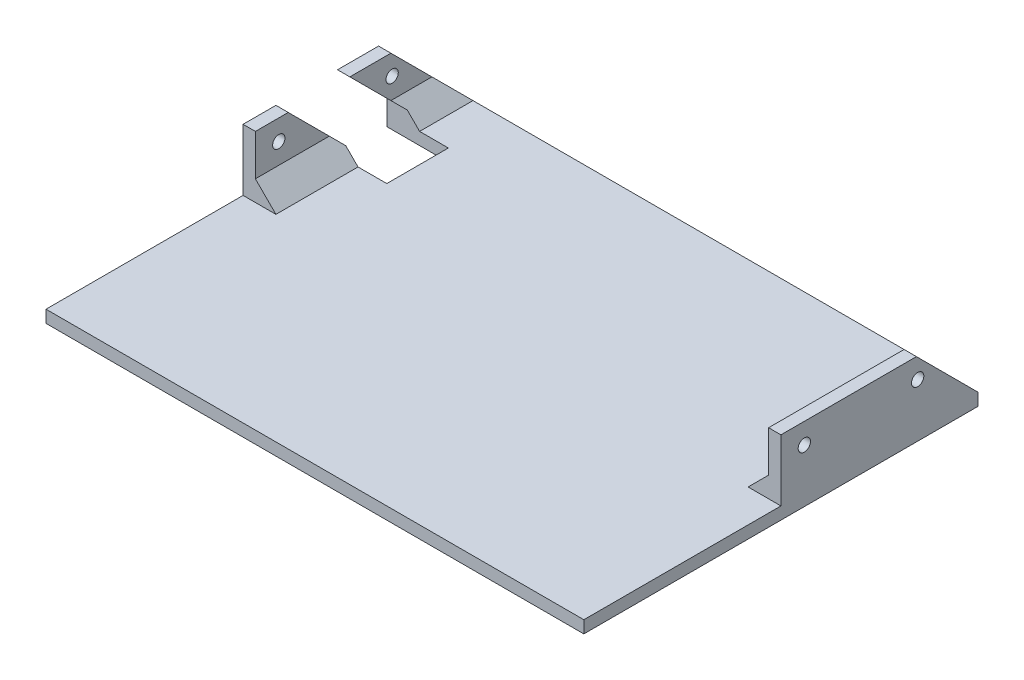
from build123d import *

# Parameters (mm, degrees)
SKETCH1_W           = 131
SKETCH1_H           = 96
BOSS_EXTRUDE1_DEPTH = 1.5
SKETCH2_R           = 1.5
BOSS_EXTRUDE2_DEPTH = 3
CHAMFER1_SIZE       = 5
CUT_EXTRUDE1_DEPTH  = 15


with BuildPart() as part:
    # Sketch1 → Boss-Extrude1 (new, symmetric)
    with BuildSketch(Plane(origin=(0, 0, 0), x_dir=(1, 0, 0), z_dir=(0, 1, 0))):
        Rectangle(SKETCH1_W, SKETCH1_H)
    extrude(amount=BOSS_EXTRUDE1_DEPTH, both=True)

    # Sketch2 → Boss-Extrude2 (add)
    with BuildSketch(Plane.ZY.offset(65.5)):
        Polygon((-33, 16.5), (-48, 1.5), (0, 1.5), (0, 16.5), align=None)
        with Locations((-33.3, 11.5)):
            Circle(SKETCH2_R, mode=Mode.SUBTRACT)
        with Locations((-5.7, 11.5)):
            Circle(SKETCH2_R, mode=Mode.SUBTRACT)
    boss_extrude2 = extrude(amount=-BOSS_EXTRUDE2_DEPTH)

    # Mirror1: Boss-Extrude2 across plane
    add(boss_extrude2.mirror(Plane(origin=(0, 0, 0), x_dir=(0, 0, 1), z_dir=(1, 0, 0))))

    # Chamfer1
    chamfer1_edges = [part.edges().sort_by_distance(p)[0] for p in [
        (-62.5, 1.5, -24),
        (62.5, 1.5, -24),
    ]]
    chamfer(chamfer1_edges, length=CHAMFER1_SIZE)

    # Sketch3 → Cut-Extrude1 (cut)
    with BuildSketch(Plane.ZY.offset(65.5)):
        Polygon((-20, -1.5), (-20, 4.5), (-8, 16.5), (-20, 16.5), (-23, 16.5), (-35, 4.5), (-35, -1.5), align=None)
    extrude(amount=-CUT_EXTRUDE1_DEPTH, mode=Mode.SUBTRACT)


solid = part.part
